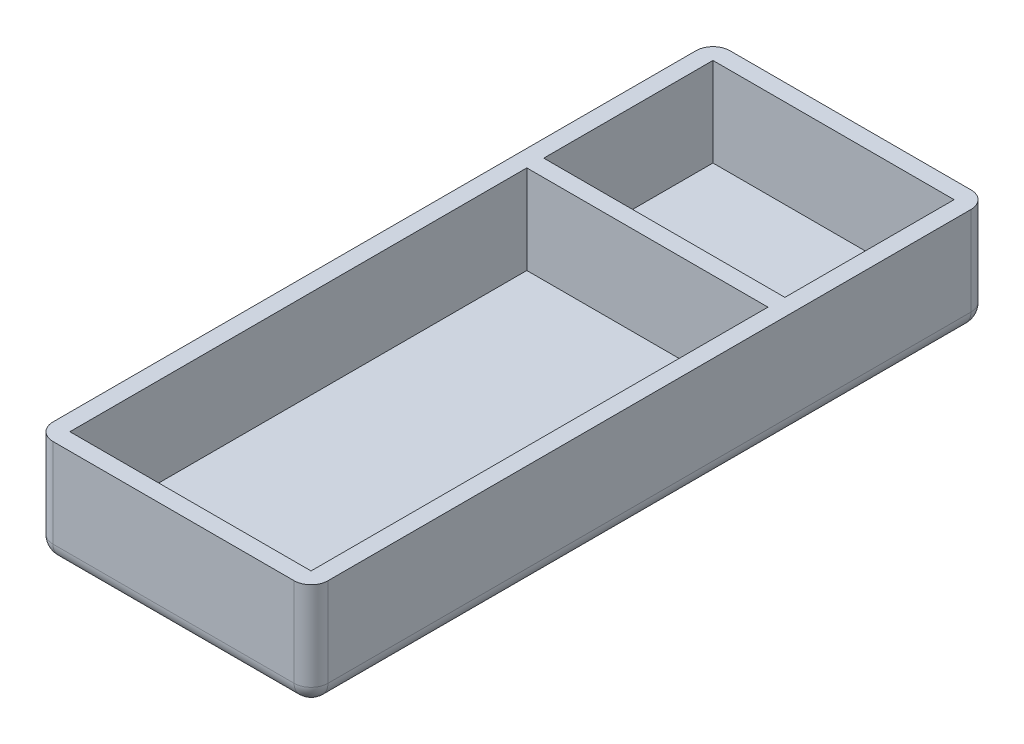
from build123d import *

# Parameters (mm, degrees)
SKETCH2_W          = 65
SKETCH2_H          = 160
BASE_DEPTH         = 25
SKETCH3_W          = 57
SKETCH3_H          = 152
INSIDE_SPACE_DEPTH = 21
SKETCH4_W          = 57
SKETCH4_H          = 4
BATTERY_WALL_DEPTH = 21
FILLET1_R          = 4


with BuildPart() as part:
    # Sketch2 → Base (new body)
    with BuildSketch(Plane(origin=(0, 0, 0), x_dir=(1, 0, 0), z_dir=(0, 1, 0))):
        Rectangle(SKETCH2_W, SKETCH2_H)
    extrude(amount=BASE_DEPTH)

    # Sketch3 → Inside Space (cut)
    with BuildSketch(Plane(origin=(0, 25, 0), x_dir=(1, 0, 0), z_dir=(0, 1, 0))):
        Rectangle(SKETCH3_W, SKETCH3_H)
    extrude(amount=-INSIDE_SPACE_DEPTH, mode=Mode.SUBTRACT)

    # Sketch4 → Battery Wall (add)
    with BuildSketch(Plane(origin=(0, 4, 0), x_dir=(1, 0, 0), z_dir=(0, 1, 0))):
        with Locations((0, 34)):
            Rectangle(SKETCH4_W, SKETCH4_H)
    extrude(amount=BATTERY_WALL_DEPTH)

    # Fillet1
    fillet1_edges = [part.edges().sort_by_distance(p)[0] for p in [
        (0, 0, -80),
        (32.5, 0, 0),
        (0, 0, 80),
        (-32.5, 0, 0),
        (-32.5, 12.5, -80),
        (32.5, 12.5, -80),
        (32.5, 12.5, 80),
        (-32.5, 12.5, 80),
    ]]
    fillet(fillet1_edges, radius=FILLET1_R)


solid = part.part
